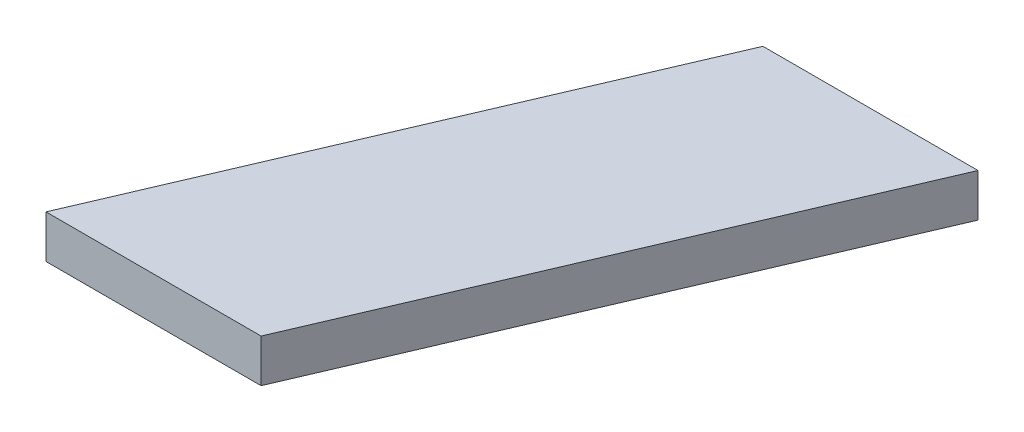
from build123d import *

# Parameters (mm, degrees)
BOSS_EXTRUDE1_DEPTH = 0.3


with BuildPart() as part:
    # Sketch1 → Boss-Extrude1 (new body)
    with BuildSketch(Plane(origin=(0, 0, 0), x_dir=(1, 0, 0), z_dir=(0, 1, 0))):
        Polygon((1.5, 3.5), (0, 3.5), (-1.5, 0), (0, 0), align=None)
    extrude(amount=BOSS_EXTRUDE1_DEPTH)


solid = part.part
